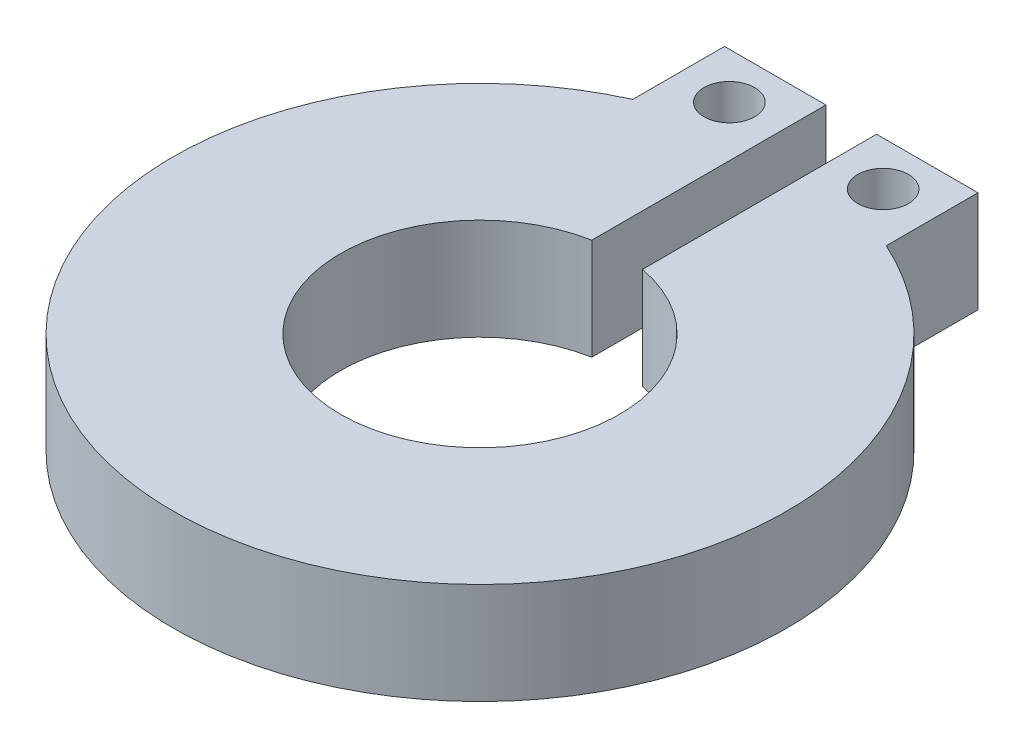
from build123d import *

# Parameters (mm, degrees)
IZIM1_R                     = 1
Y_KSEKLIK_EKSTR_ZYON1_DEPTH = 4


with BuildPart() as part:
    # Çizim1 → Yükseklik-Ekstrüzyon1 (new body)
    with BuildSketch(Plane(origin=(0, 0, 0), x_dir=(1, 0, 0), z_dir=(0, 1, 0))):
        with BuildLine():
            Line((-5, 14.645680769), (-5, 11.026106076))
            ThreePointArc((-5, 11.026106076), (0, -12.10681689), (5, 11.026106076))
            Line((5, 11.026106076), (5, 14.645680769))
            Line((5, 14.645680769), (1, 14.645680769))
            Line((1, 14.645680769), (1, 5.408326913))
            ThreePointArc((1, 5.408326913), (0, -5.5), (-1, 5.408326913))
            Line((-1, 5.408326913), (-1, 14.645680769))
            Line((-1, 14.645680769), (-5, 14.645680769))
        make_face()
        with Locations(Location((3, 12.903127357, 0), (0, 0, 270))):
            Circle(IZIM1_R, mode=Mode.SUBTRACT)
        with Locations(Location((-3, 12.835893423, 0), (0, 0, 270))):
            Circle(IZIM1_R, mode=Mode.SUBTRACT)
    extrude(amount=Y_KSEKLIK_EKSTR_ZYON1_DEPTH)


solid = part.part
